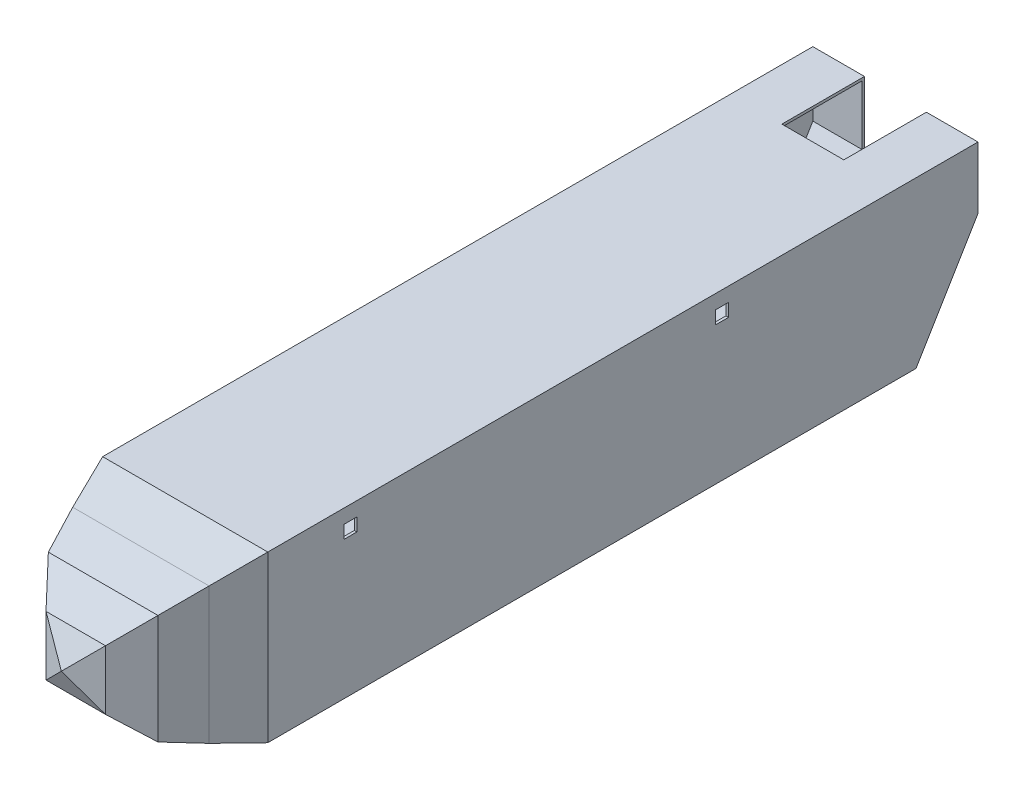
from build123d import *

# Parameters (mm, degrees)
SKETCH1_W           = 101.6
SKETCH1_H           = 101.6
BOSS_EXTRUDE1_DEPTH = 436.88
SHELL1_T            = -1.5875
SKETCH9_W           = 8.001
SKETCH9_H           = 8.001
CUT_EXTRUDE1_DEPTH  = 526.503840631
CUT_EXTRUDE2_DEPTH  = 526.503840631
BOSS_EXTRUDE2_DEPTH = 101.6
SKETCH12_W          = 38.1
SKETCH12_H          = 38.1
CUT_EXTRUDE3_DEPTH  = 50.8


with BuildPart() as part:
    # Sketch1 → Boss-Extrude1 (new body)
    with BuildSketch(Plane.XY):
        Rectangle(SKETCH1_W, SKETCH1_H)
    extrude(amount=BOSS_EXTRUDE1_DEPTH)

    # Sketch5 → Loft2 section 0
    with BuildSketch(Plane.XY.offset(436.88)):
        with BuildLine():
            Line((50.8, -50.8), (50.8, 50.8))
            Line((50.8, 50.8), (-50.8, 50.8))
            Line((-50.8, 50.8), (-50.8, -50.8))
            Line((-50.8, -50.8), (50.8, -50.8))
        make_face()
    # Sketch3 → Loft2 section 1
    with BuildSketch(Plane.XY.offset(464.156588322)):
        with BuildLine():
            Line((-41.937305, -41.937305), (41.937305, -41.937305))
            Line((41.937305, -41.937305), (41.937305, 41.937305))
            Line((41.937305, 41.937305), (-41.937305, 41.937305))
            Line((-41.937305, 41.937305), (-41.937305, -41.937305))
        make_face()
    loft()

    # Sketch3<6> → Loft3 section 0
    with BuildSketch(Plane.XY.offset(464.156588322)):
        with BuildLine():
            Line((-41.937305, -41.937305), (41.937305, -41.937305))
            Line((41.937305, -41.937305), (41.937305, 41.937305))
            Line((41.937305, 41.937305), (-41.937305, 41.937305))
            Line((-41.937305, 41.937305), (-41.937305, -41.937305))
        make_face()
    # Sketch6 → Loft3 section 1
    with BuildSketch(Plane.XY.offset(487.359440316)):
        with BuildLine():
            Line((-33.71596, -33.71596), (33.71596, -33.71596))
            Line((33.71596, -33.71596), (33.71596, 33.71596))
            Line((33.71596, 33.71596), (-33.71596, 33.71596))
            Line((-33.71596, 33.71596), (-33.71596, -33.71596))
        make_face()
    loft()

    # Sketch6<4> → Loft4 section 0
    with BuildSketch(Plane.XY.offset(487.359440316)):
        with BuildLine():
            Line((-33.71596, -33.71596), (33.71596, -33.71596))
            Line((33.71596, -33.71596), (33.71596, 33.71596))
            Line((33.71596, 33.71596), (-33.71596, 33.71596))
            Line((-33.71596, 33.71596), (-33.71596, -33.71596))
        make_face()
    # Sketch7 → Loft4 section 1
    with BuildSketch(Plane.XY.offset(504.217299158)):
        with BuildLine():
            Line((-18.304143458, -18.304143458), (18.304143458, -18.304143458))
            Line((18.304143458, -18.304143458), (18.304143458, 18.304143458))
            Line((18.304143458, 18.304143458), (-18.304143458, 18.304143458))
            Line((-18.304143458, 18.304143458), (-18.304143458, -18.304143458))
        make_face()
    loft()

    # Sketch7<5> → Loft5 section 0
    with BuildSketch(Plane.XY.offset(504.217299158), mode=Mode.PRIVATE) as loft5_s0:
        with BuildLine():
            Line((-18.304143458, -18.304143458), (18.304143458, -18.304143458))
            Line((18.304143458, -18.304143458), (18.304143458, 18.304143458))
            Line((18.304143458, 18.304143458), (-18.304143458, 18.304143458))
            Line((-18.304143458, 18.304143458), (-18.304143458, -18.304143458))
        make_face()
    loft([Vertex(0, 0, 513.079999985), loft5_s0.sketch])

    # Shell1
    shell1_openings = [part.faces().sort_by_distance(p)[0] for p in [
        (0, 0, 0),
    ]]
    offset(amount=SHELL1_T, openings=shell1_openings, kind=Kind.INTERSECTION)

    # Sketch9 → Cut-Extrude1 (cut, through all)
    with BuildSketch(Plane(origin=(50.8, 0, 0), x_dir=(0, 0, -1), z_dir=(1, 0, 0))):
        with Locations((-386.08, 38.1)):
            Rectangle(SKETCH9_W, SKETCH9_H)
        Polygon((-161.4805, 42.1005), (-161.4805, 38.1), (-161.4805, 34.0995), (-153.4795, 34.0995), (-153.4795, 42.1005), align=None)
    extrude(amount=-CUT_EXTRUDE1_DEPTH, mode=Mode.SUBTRACT)

    # Sketch10 → Cut-Extrude2 (cut, through all)
    with BuildSketch(Plane(origin=(50.8, 0, 0), x_dir=(0, 0, -1), z_dir=(1, 0, 0))):
        Polygon((0, -50.8), (0, 12.7), (-38.1, -50.8), align=None)
    extrude(amount=-CUT_EXTRUDE2_DEPTH, mode=Mode.SUBTRACT)

    # Sketch11 → Boss-Extrude2 (add)
    with BuildSketch(Plane(origin=(50.8, 0, 0), x_dir=(0, 0, -1), z_dir=(1, 0, 0))):
        Polygon((-38.1, -50.8), (-39.6875, -50.8), (-1.5875, 12.7), (-1.5875, 50.8), (0, 50.8), (0, 12.7), align=None)
    extrude(amount=-BOSS_EXTRUDE2_DEPTH)

    # Sketch12 → Cut-Extrude3 (cut)
    with BuildSketch(Plane(origin=(0, 0, 0), x_dir=(-1, 0, 0), z_dir=(0, 0, -1))):
        with Locations((0, 31.75)):
            Rectangle(SKETCH12_W, SKETCH12_H)
    extrude(amount=-CUT_EXTRUDE3_DEPTH, mode=Mode.SUBTRACT)


solid = part.part
